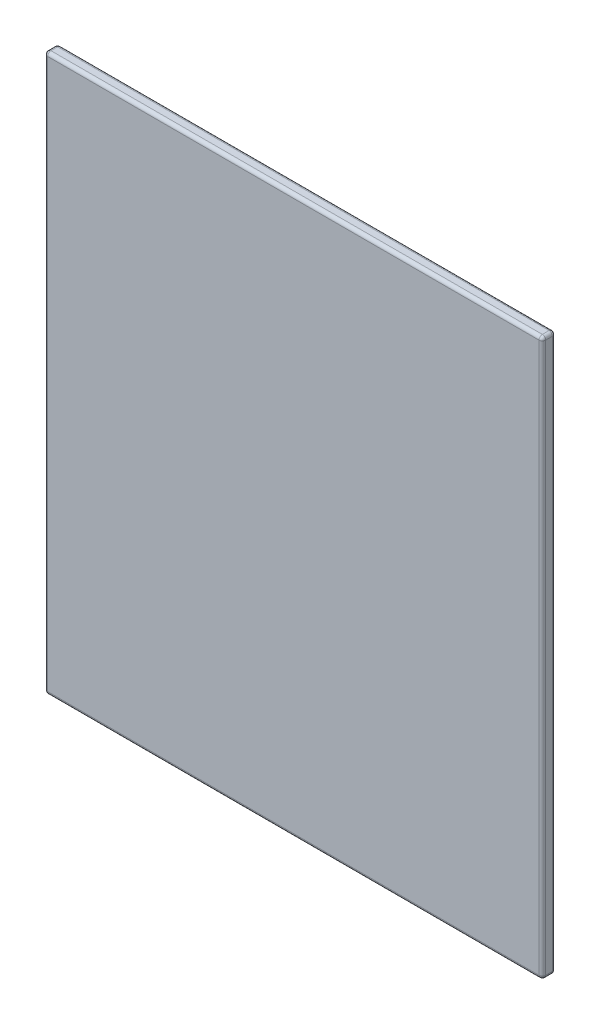
from build123d import *

# Parameters (mm, degrees)
SKETCH1_W           = 74.7
SKETCH1_H           = 83.5
BOSS_EXTRUDE1_DEPTH = 2
FILLET1_R           = 0.5


with BuildPart() as part:
    # Sketch1 → Boss-Extrude1 (new body)
    with BuildSketch(Plane.XY):
        Rectangle(SKETCH1_W, SKETCH1_H)
    extrude(amount=BOSS_EXTRUDE1_DEPTH)

    # Fillet1
    fillet1_edges = [part.edges().sort_by_distance(p)[0] for p in [
        (-37.35, 0, 2),
        (0, -41.75, 2),
        (37.35, 0, 2),
        (0, -41.75, 0),
        (-37.35, 0, 0),
        (0, 41.75, 0),
        (37.35, 0, 0),
        (37.35, -41.75, 1),
        (-37.35, -41.75, 1),
        (-37.35, 41.75, 1),
        (37.35, 41.75, 1),
        (0, 41.75, 2),
    ]]
    fillet(fillet1_edges, radius=FILLET1_R)


solid = part.part
